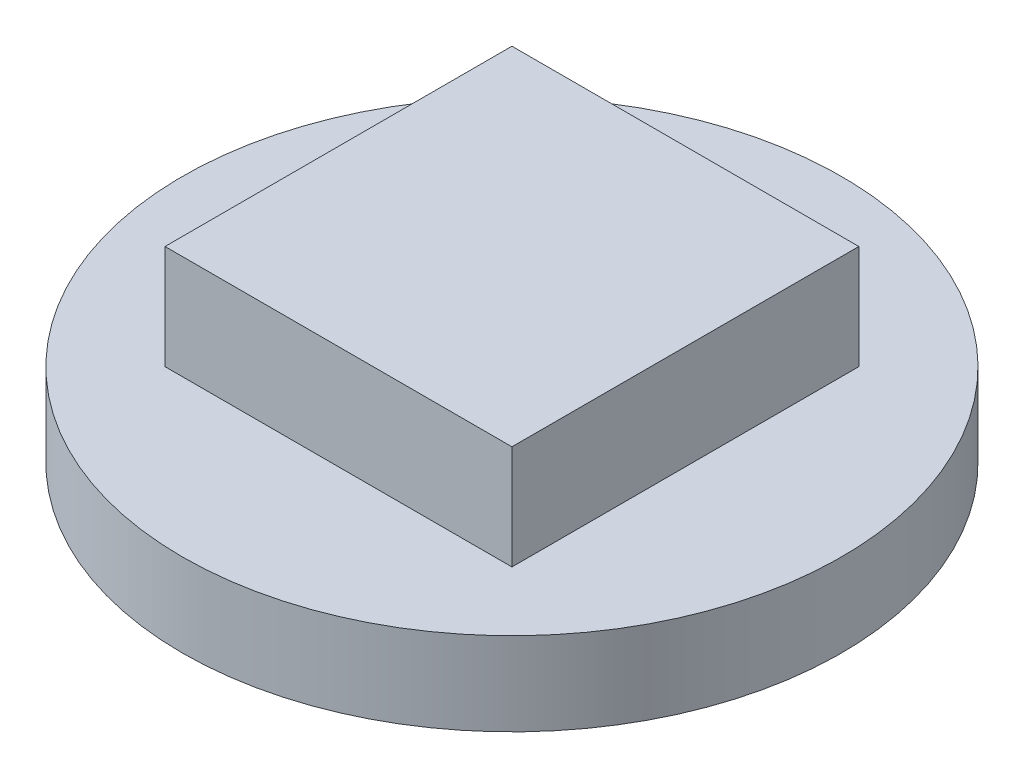
from build123d import *

# Parameters (mm, degrees)
SKETCH1_R           = 4.75
BOSS_EXTRUDE1_DEPTH = 1.2
SKETCH2_W           = 5
SKETCH2_H           = 5
BOSS_EXTRUDE2_DEPTH = 1.5


with BuildPart() as part:
    # Sketch1 → Boss-Extrude1 (new body)
    with BuildSketch(Plane(origin=(0, 0, 0), x_dir=(1, 0, 0), z_dir=(0, 1, 0))):
        with Locations(Location((0, 0, 0), (0, 0, 270))):
            Circle(SKETCH1_R)
    extrude(amount=-BOSS_EXTRUDE1_DEPTH)

    # Sketch2 → Boss-Extrude2 (add)
    with BuildSketch(Plane(origin=(0, 0, 0), x_dir=(1, 0, 0), z_dir=(0, 1, 0))):
        Rectangle(SKETCH2_W, SKETCH2_H)
    extrude(amount=BOSS_EXTRUDE2_DEPTH)


solid = part.part
